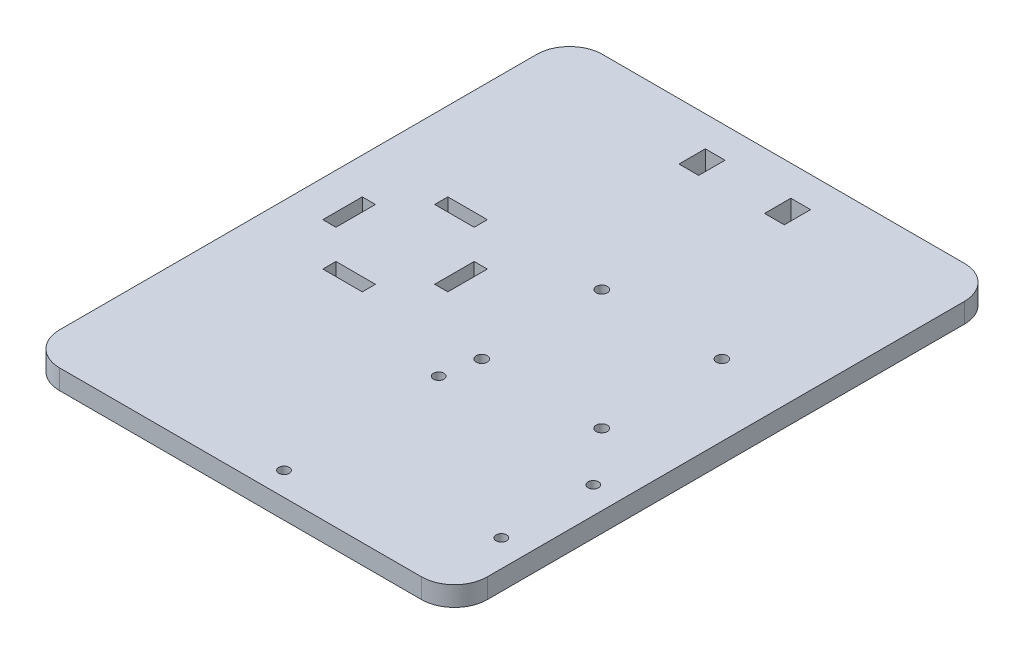
from build123d import *

# Parameters (mm, degrees)
SKETCH1_R           = 1.7
SKETCH1_R_2         = 1.5875
SKETCH1_W           = 4
SKETCH1_H           = 12
SKETCH1_W_2         = 12
SKETCH1_H_2         = 4
SKETCH1_W_3         = 6
SKETCH1_H_3         = 8
BOSS_EXTRUDE2_DEPTH = 6


with BuildPart() as part:
    # Sketch1 → Boss-Extrude2 (new body)
    with BuildSketch(Plane(origin=(0, 0, 0), x_dir=(1, 0, 0), z_dir=(0, 1, 0))):
        with BuildLine():
            Line((90, 80), (-20, 80))
            ThreePointArc((-20, 80), (-27.071067812, 77.071067812), (-30, 70))
            Line((-30, 70), (-30, -75))
            ThreePointArc((-30, -75), (-27.071067812, -82.071067812), (-20, -85))
            Line((-20, -85), (90, -85))
            ThreePointArc((90, -85), (97.071067812, -82.071067812), (100, -75))
            Line((100, -75), (100, 70))
            ThreePointArc((100, 70), (97.071067812, 77.071067812), (90, 80))
        make_face()
        with Locations(Location((41.804775222, 18, 0), (0, 0, 270))):
            Circle(SKETCH1_R, mode=Mode.SUBTRACT)
        with Locations(Location((78.304775222, 17.96923253, 0), (0, 0, 270))):
            Circle(SKETCH1_R, mode=Mode.SUBTRACT)
        with Locations(Location((78.304775222, -18.53076747, 0), (0, 0, 270))):
            Circle(SKETCH1_R, mode=Mode.SUBTRACT)
        with Locations(Location((41.804775222, -18.5, 0), (0, 0, 270))):
            Circle(SKETCH1_R, mode=Mode.SUBTRACT)
        with Locations(Location((39.806499109, -29.593870337, 0), (0, 0, 270))):
            Circle(SKETCH1_R_2, mode=Mode.SUBTRACT)
        with Locations(Location((91.876499109, -34.673870337, 0), (0, 0, 270))):
            Circle(SKETCH1_R_2, mode=Mode.SUBTRACT)
        with Locations(Location((91.876499109, -62.613870337, 0), (0, 0, 270))):
            Circle(SKETCH1_R_2, mode=Mode.SUBTRACT)
        with Locations(Location((41.076499109, -77.853870337, 0), (0, 0, 270))):
            Circle(SKETCH1_R_2, mode=Mode.SUBTRACT)
        with Locations((-17, 0)):
            Rectangle(SKETCH1_W, SKETCH1_H, mode=Mode.SUBTRACT)
        with Locations((0, 17)):
            Rectangle(SKETCH1_W_2, SKETCH1_H_2, mode=Mode.SUBTRACT)
        with Locations((17, 0)):
            Rectangle(SKETCH1_W, SKETCH1_H, mode=Mode.SUBTRACT)
        with Locations((0, -17)):
            Rectangle(SKETCH1_W_2, SKETCH1_H_2, mode=Mode.SUBTRACT)
        with Locations((23.479105259, 66.763598247)):
            Rectangle(SKETCH1_W_3, SKETCH1_H_3, mode=Mode.SUBTRACT)
        with Locations((49.479105259, 66.763598247)):
            Rectangle(SKETCH1_W_3, SKETCH1_H_3, mode=Mode.SUBTRACT)
    extrude(amount=BOSS_EXTRUDE2_DEPTH)


solid = part.part
